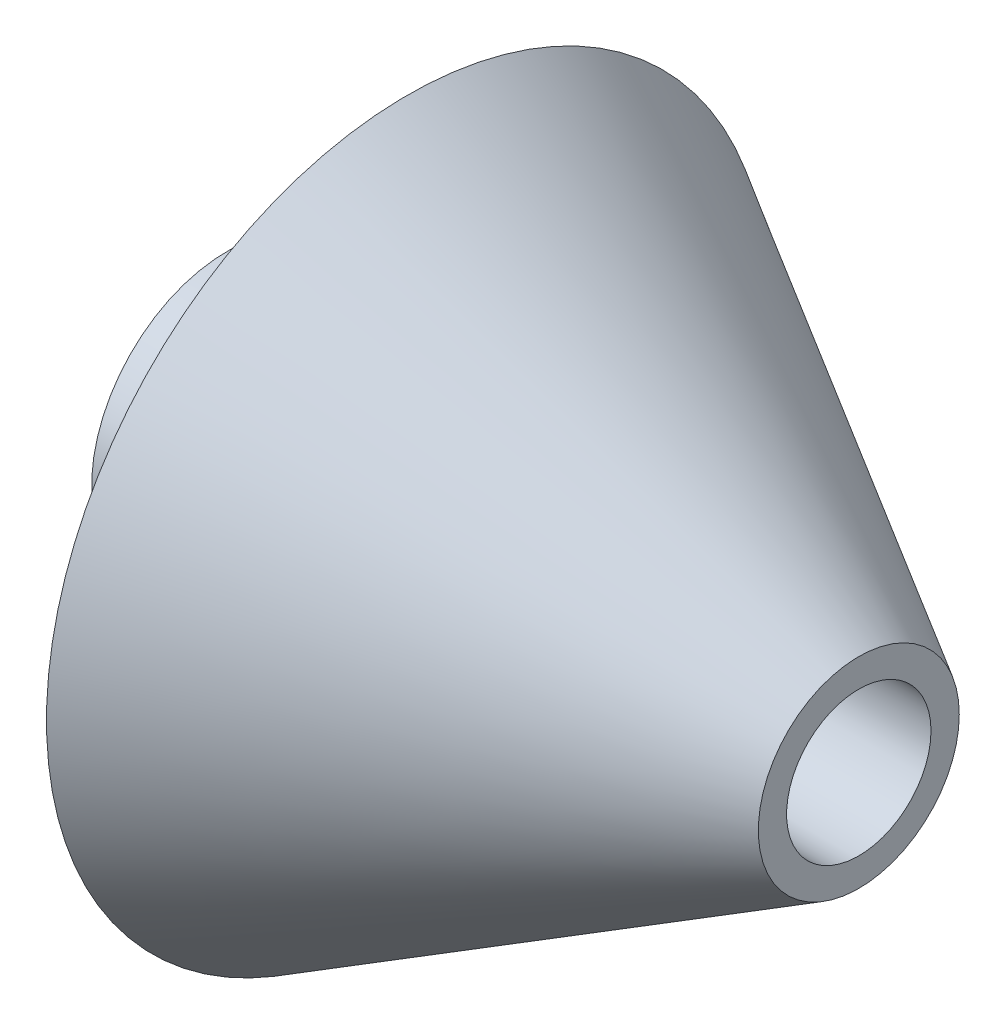
from build123d import *

# Parameters (mm, degrees)
CROQUIS1_R                        = 7.5
SALIENTE_EXTRUIR1_DEPTH           = 10
CROQUIS2_R                        = 20
SALIENTE_EXTRUIR2_DEPTH           = 25
SALIENTE_EXTRUIR2_TAPER           = 30
CROQUIS3_R                        = 4
CORTAR_EXTRUIR2_DEPTH             = 70
TALADRO_DE_MARGEN_PARA_M41_REACH  = 47.571
TALADRO_DE_MARGEN_PARA_M41_BORE_R = 2.25


with BuildPart() as part:
    # Croquis1 → Saliente-Extruir1 (new body)
    with BuildSketch(Plane(origin=(0, 0, 0), x_dir=(0, 0, -1), z_dir=(1, 0, 0))):
        Circle(CROQUIS1_R)
    extrude(amount=SALIENTE_EXTRUIR1_DEPTH)

    # Croquis2 → Saliente-Extruir2 (add)
    with BuildSketch(Plane(origin=(10, 0, 0), x_dir=(0, 0, -1), z_dir=(1, 0, 0))):
        Circle(CROQUIS2_R)
    extrude(amount=SALIENTE_EXTRUIR2_DEPTH, taper=SALIENTE_EXTRUIR2_TAPER)

    # Croquis3 → Cortar-Extruir2 (cut)
    with BuildSketch(Plane(origin=(35, 0, 0), x_dir=(0, 0, -1), z_dir=(1, 0, 0))):
        Circle(CROQUIS3_R)
    extrude(amount=-CORTAR_EXTRUIR2_DEPTH, mode=Mode.SUBTRACT)

    # Taladro de margen para M41 bore (on position points) → Taladro de margen para M41 (cut, up to next)
    with BuildSketch(Plane(origin=(5, 7.481198926, -0.530718977), x_dir=(0, 0.070762530204, 0.997493190112), z_dir=(0, 0.997493190112, -0.070762530204)), mode=Mode.PRIVATE) as taladro_de_margen_para_m41_sk1:
        Circle(TALADRO_DE_MARGEN_PARA_M41_BORE_R)
    taladro_de_margen_para_m41_tool1 = extrude(taladro_de_margen_para_m41_sk1.sketch, amount=-TALADRO_DE_MARGEN_PARA_M41_REACH, mode=Mode.PRIVATE) & part.part
    add(taladro_de_margen_para_m41_tool1.solids().sort_by_distance((5, 7.481199, -0.530719))[0], mode=Mode.SUBTRACT)


solid = part.part
